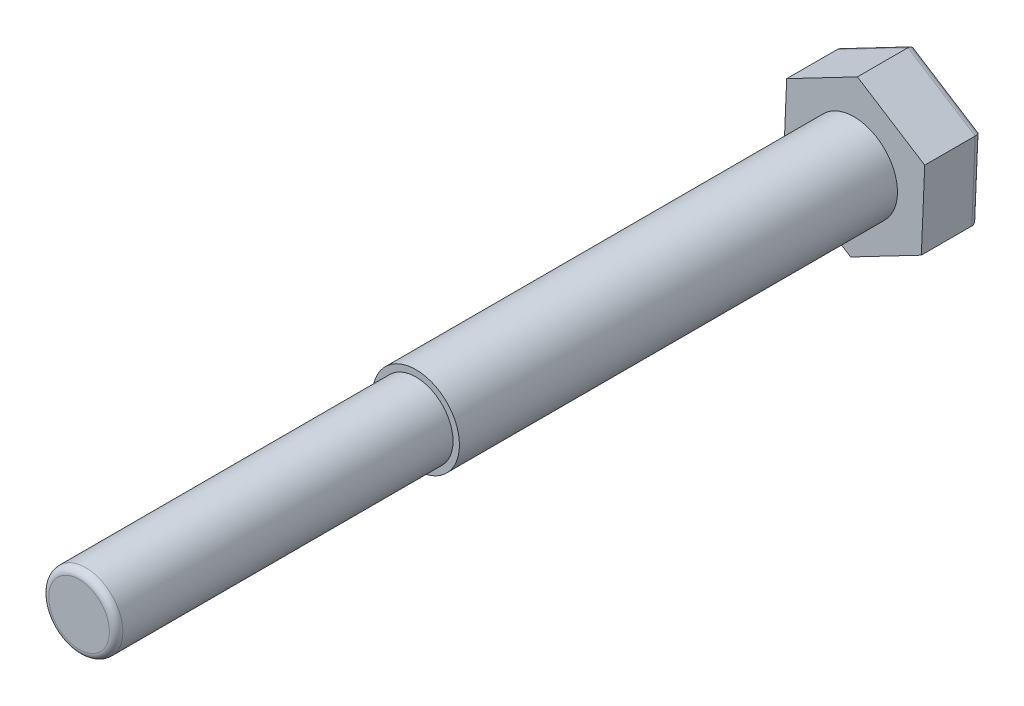
from build123d import *

# Parameters (mm, degrees)
EXTRUDE_302_DEPTH = 17
SKETCH_2_R        = 12.9
EXTRUDE_1_DEPTH   = 130
FILLET_3_R        = 2
SKETCH_3_R        = 11
EXTRUDE_2_DEPTH   = 100
FILLET_4_R        = 2


with BuildPart() as part:
    # 草图1 → Extrude 302 (new body)
    with BuildSketch(Plane.XY):
        Polygon((20.984201837, 10.954296262), (1.005402075, 23.65), (-19.978799762, 12.695703738), (-20.984201837, -10.954296262), (-1.005402075, -23.65), (19.978799762, -12.695703738), align=None)
    extrude(amount=EXTRUDE_302_DEPTH)

    # 草图2 → 凸台-拉伸1 (add)
    with BuildSketch(Plane.XY.offset(17)):
        with Locations(Location((0, 0, 0), (0, 0, 180))):
            Circle(SKETCH_2_R)
    extrude(amount=EXTRUDE_1_DEPTH)

    # 圆角3
    fillet_3_edges = [part.edges().sort_by_distance(p)[0] for p in [
        (9.486698843, -18.172851869, 0),
        (-10.994801956, -17.302148131, 0),
        (-20.4815008, 0.870703738, 0),
        (-9.486698843, 18.172851869, 0),
        (10.994801956, 17.302148131, 0),
        (20.4815008, -0.870703738, 0),
    ]]
    fillet(fillet_3_edges, radius=FILLET_3_R)

    # 草图3 → 凸台-拉伸2 (add)
    with BuildSketch(Plane.XY.offset(147)):
        Circle(SKETCH_3_R)
    extrude(amount=EXTRUDE_2_DEPTH)

    # 圆角4
    fillet_4_edges = [part.edges().sort_by_distance(p)[0] for p in [
        (-11, 0, 247),
    ]]
    fillet(fillet_4_edges, radius=FILLET_4_R)


solid = part.part
